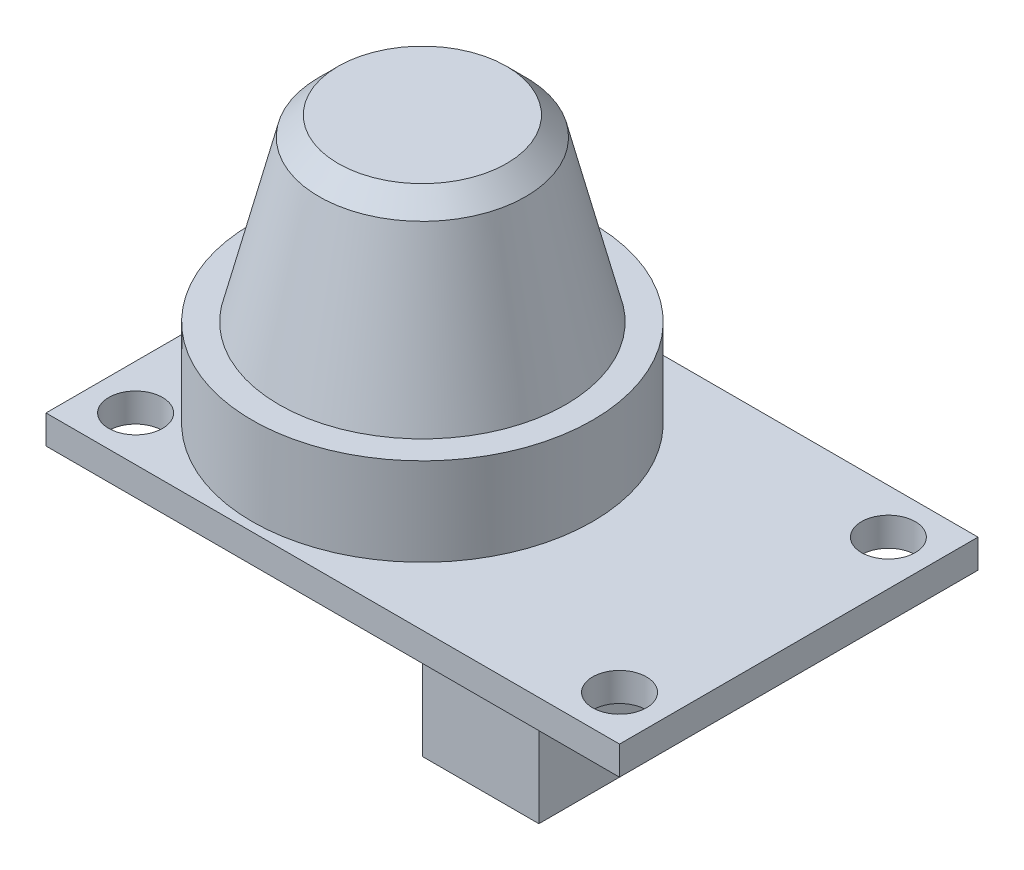
from build123d import *

# Parameters (mm, degrees)
SKETCH_1_W      = 32
SKETCH_1_H      = 20
SKETCH_1_R      = 1.5
EXTRUDE_1_DEPTH = 1.6
SKETCH_2_W      = 6.5
SKETCH_2_H      = 6.5
EXTRUDE_2_DEPTH = 5
SKETCH_3_R      = 9.5
EXTRUDE_3_DEPTH = 16.5


with BuildPart() as part:
    # 草图1 → 凸台-拉伸1 (new body)
    with BuildSketch(Plane(origin=(0, 0, 0), x_dir=(1, 0, 0), z_dir=(0, 1, 0))):
        Rectangle(SKETCH_1_W, SKETCH_1_H)
        with Locations(Location((-13.5, 7.5, 0), (0, 0, 270))):
            Circle(SKETCH_1_R, mode=Mode.SUBTRACT)
        with Locations(Location((13.5, 7.5, 0), (0, 0, 270))):
            Circle(SKETCH_1_R, mode=Mode.SUBTRACT)
        with Locations(Location((-13.5, -7.5, 0), (0, 0, 270))):
            Circle(SKETCH_1_R, mode=Mode.SUBTRACT)
        with Locations(Location((13.5, -7.5, 0), (0, 0, 270))):
            Circle(SKETCH_1_R, mode=Mode.SUBTRACT)
    extrude(amount=EXTRUDE_1_DEPTH)

    # 草图2 → 凸台-拉伸2 (add)
    with BuildSketch(Plane(origin=(0, 0, 0), x_dir=(1, 0, 0), z_dir=(0, 1, 0))):
        with Locations((7.75, -6.25)):
            Rectangle(SKETCH_2_W, SKETCH_2_H)
    extrude(amount=-EXTRUDE_2_DEPTH)

    # 草图3 → 凸台-拉伸3 (add)
    with BuildSketch(Plane(origin=(0, 0, 0), x_dir=(1, 0, 0), z_dir=(0, 1, 0))):
        with Locations(Location((-5, 0, 0), (0, 0, 270))):
            Circle(SKETCH_3_R)
    extrude(amount=EXTRUDE_3_DEPTH)

    # 草图4 → 切除-旋转2 (revolve, cut)
    with BuildSketch(Plane.XY):
        Polygon((-0.3, 16.5), (0.5, 16.5), (4.5, 16.5), (4.5, 6.5), (3, 6.5), (0.766666667, 15.433333333), align=None)
    revolve(axis=Axis((-5, -983.5, 0), (0, 1, 0)), mode=Mode.SUBTRACT)


solid = part.part
